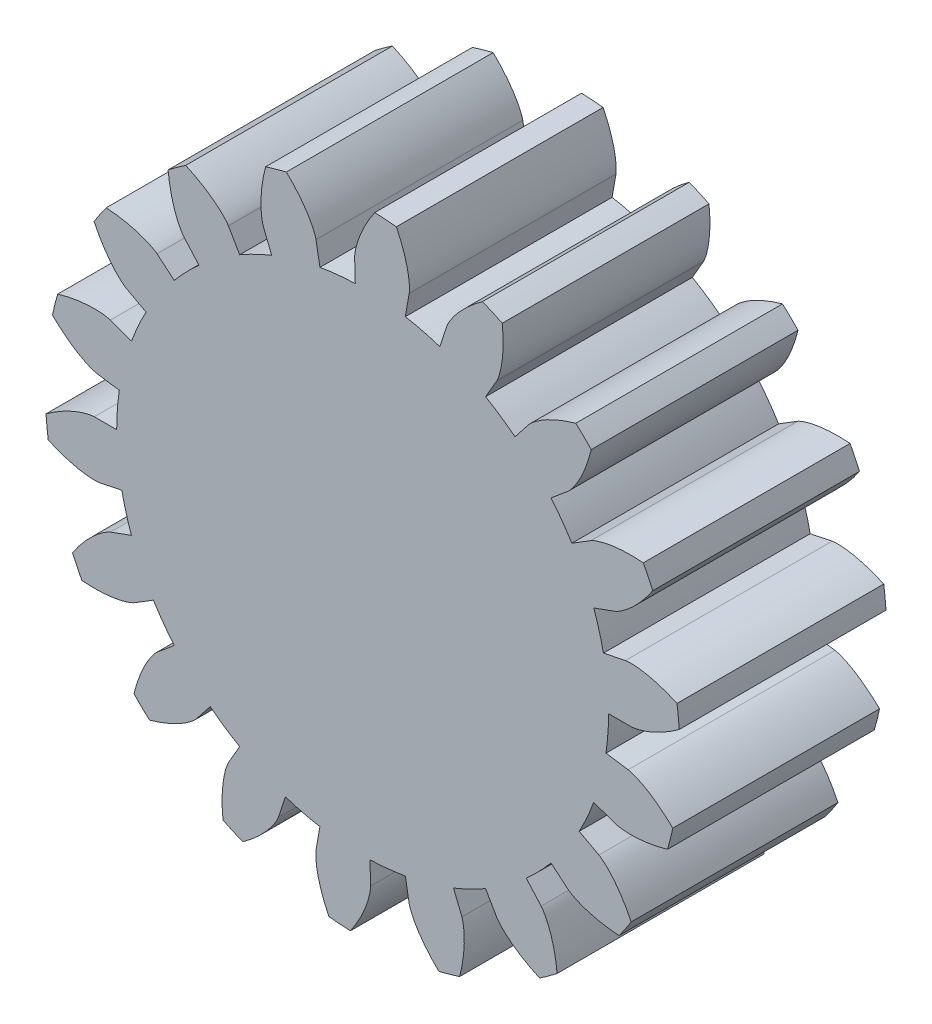
from build123d import *

# Parameters (mm, degrees)
SKETCH1_R           = 5
BOSS_EXTRUDE1_DEPTH = 1.6289364
CUT_EXTRUDE1_DEPTH  = 8.256268586
CIRPATTERN2_COUNT   = 18


with BuildPart() as part:
    # Sketch1 → Boss-Extrude1 (new, symmetric)
    with BuildSketch(Plane.XY):
        Circle(SKETCH1_R)
    extrude(amount=BOSS_EXTRUDE1_DEPTH, both=True)

    # Sketch2 → Cut-Extrude1 (cut, symmetric)
    with BuildSketch(Plane.XY):
        with BuildLine():
            add(Edge.make_bspline(
                [(4.228616795, 0), (4.232672129, 5.8344e-05), (4.24033322, 0.000506661), (4.252818095, 0.001603481), (4.277394074, 0.004702216), (4.30506317, 0.009479016), (4.336175609, 0.016127445), (4.369448005, 0.024521933), (4.397780511, 0.03247242), (4.425924704, 0.041120594), (4.453846028, 0.050380899), (4.487519746, 0.062357482), (4.527684118, 0.077772504), (4.574286281, 0.097315971), (4.626709568, 0.12127472), (4.67963262, 0.147593893), (4.731279137, 0.175049421), (4.78292419, 0.204561701), (4.832510062, 0.234371294), (4.883413622, 0.267125407), (4.926466455, 0.295849553), (4.960804362, 0.320224804), (4.980513884, 0.334433431), (4.988414161, 0.340182532)],
                knots=[0, 0, 0, 0, 0, 0.015083688, 0.02853182, 0.04661014, 0.092110525, 0.119476176, 0.146842496, 0.174208854, 0.201574956, 0.228941013, 0.256307345, 0.307035032, 0.361767352, 0.416499661, 0.471231937, 0.525964282, 0.580696616, 0.635428982, 0.690161387, 0.744893688, 0.782595302, 0.782595302, 0.782595302, 0.782595302, 0.782595302], degree=4))
            Line((4.228616795, 0), (3.875, 0))
            ThreePointArc((3.875, 0), (3.864859152, -0.280158408), (3.834489686, -0.558850471))
            Line((3.834489686, -0.558850471), (4.184409674, -0.6098489))
            add(Edge.make_bspline(
                [(4.184409674, -0.6098489), (4.188414198, -0.610491492), (4.195930542, -0.612040002), (4.208126713, -0.614925917), (4.231998871, -0.621536592), (4.258689798, -0.630253877), (4.288518147, -0.64131982), (4.320232056, -0.654425077), (4.347121751, -0.666378547), (4.373724481, -0.678995251), (4.400018392, -0.692185546), (4.431612819, -0.708893328), (4.469134155, -0.729939682), (4.512430577, -0.755999775), (4.560850499, -0.787268512), (4.609424542, -0.820945072), (4.65657151, -0.855562006), (4.703420406, -0.892213979), (4.748188769, -0.928863183), (4.793836389, -0.968616161), (4.832296554, -1.003249073), (4.862760097, -1.032321694), (4.88021441, -1.049224276), (4.887202963, -1.056052649)],
                knots=[0, 0, 0, 0, 0, 0.015083688, 0.02853182, 0.04661014, 0.092110525, 0.119476176, 0.146842496, 0.174208854, 0.201574956, 0.228941013, 0.256307345, 0.307035032, 0.361767352, 0.416499661, 0.471231937, 0.525964282, 0.580696616, 0.635428982, 0.690161387, 0.744893688, 0.782595302, 0.782595302, 0.782595302, 0.782595302, 0.782595302], degree=4))
            ThreePointArc((4.887202963, -1.056052649), (4.971720769, -0.531029747), (5, 0))
            ThreePointArc((5, 0), (4.997102701, 0.170189884), (4.988414161, 0.340182532))
        make_face()
    cut_extrude1 = extrude(amount=CUT_EXTRUDE1_DEPTH, both=True, mode=Mode.SUBTRACT)

    # CirPattern2: Cut-Extrude1 ×18 about axis
    cirpattern2_axis = Axis((0, 0, 1.6289364), (0, 0, -1))
    for i in range(1, CIRPATTERN2_COUNT):
        add(cut_extrude1.rotate(cirpattern2_axis, i * 360 / CIRPATTERN2_COUNT), mode=Mode.SUBTRACT)


solid = part.part
